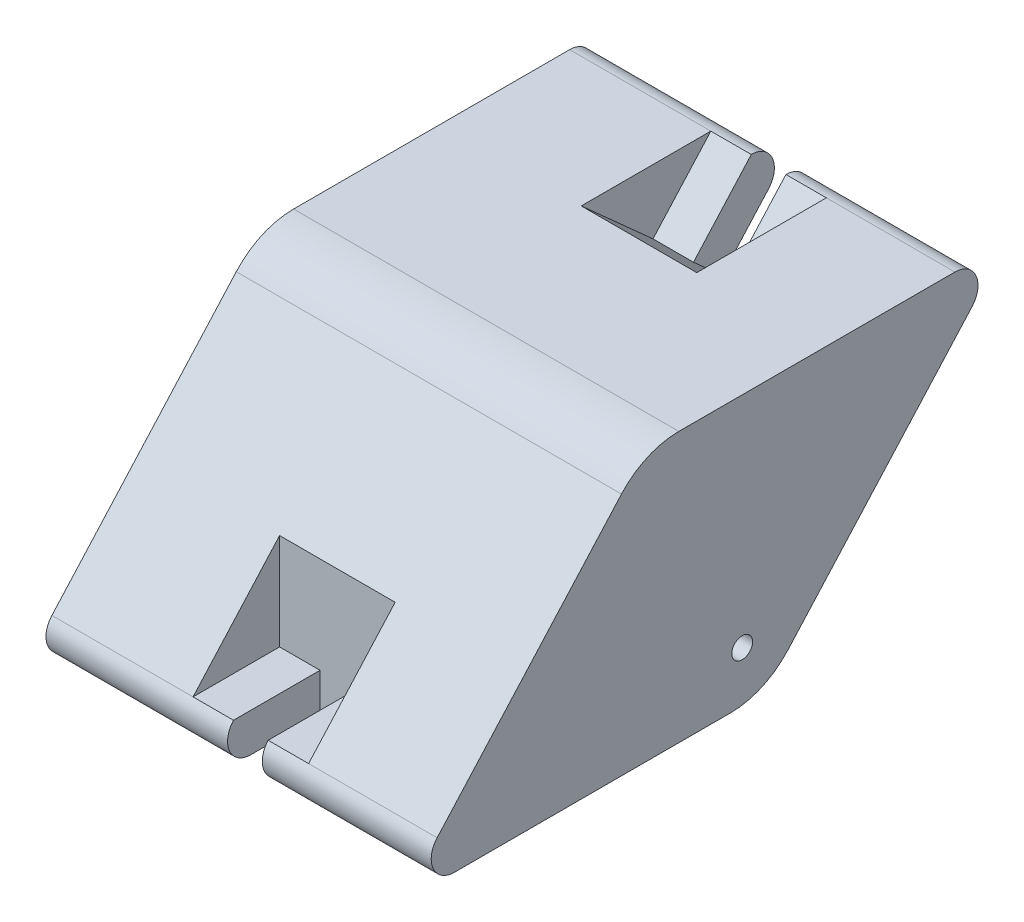
from build123d import *

# Parameters (mm, degrees)
SKETCH4_R            = 3.6
THICKBASE_DEPTH      = 10
MIDDLE_DEPTH         = 35
THINBASE_DEPTH       = 5
SKETCH8_R            = 1.35
RETAINERSCREW_DEPTH  = 5
SKETCH9_R            = 3
SKETCH9_R_2          = 1.35
SPACER_DEPTH         = 7.2
SHOCKHOLE_START      = -35
SKETCH10_W           = 4.5
SKETCH10_H           = 12
SHOCKHOLE_DEPTH      = 17.524613
SKETCH12_W           = 15
SKETCH12_H           = 12.521275246
SHOCKHOLEBASE_DEPTH  = 82.308539587
SKETCH11_W           = 4.5
SKETCH11_H           = 12
SHOCKHOLE2_DEPTH     = 35
SKETCH13_W           = 15
SKETCH13_H           = 12.521275247
SHOCKHOLE2BASE_DEPTH = 80.489490329


with BuildPart() as part:
    # Sketch4 → ThickBase (new body)
    with BuildSketch(Plane(origin=(0, 0, 0), x_dir=(0, 0, -1), z_dir=(1, 0, 0))):
        with BuildLine():
            Line((-14.01318338, 16.550216151), (21.822267157, 16.550216151))
            ThreePointArc((21.822267157, 16.550216151), (24.561793845, 14.77291543), (24.055345362, 11.546878503))
            Line((24.055345362, 11.546878503), (0.125176293, -15.12757601))
            ThreePointArc((0.125176293, -15.12757601), (-3.242753458, -17.581539475), (-7.318417722, -18.449783849))
            Line((-7.318417722, -18.449783849), (-43.153868259, -18.449783849))
            ThreePointArc((-43.153868259, -18.449783849), (-45.893394947, -16.672483128), (-45.386946464, -13.446446201))
            Line((-45.386946464, -13.446446201), (-21.456777395, 13.228008312))
            ThreePointArc((-21.456777395, 13.228008312), (-18.088847644, 15.681971777), (-14.01318338, 16.550216151))
        make_face()
        with Locations((-5.952745457, -11.509649573)):
            Circle(SKETCH4_R, mode=Mode.SUBTRACT)
    extrude(amount=THICKBASE_DEPTH)

    # Sketch5 → Middle (add)
    with BuildSketch(Plane(origin=(10, 0, 0), x_dir=(0, 0, -1), z_dir=(1, 0, 0))):
        with BuildLine():
            Line((15.945305194, 2.506787856), (24.055345362, 11.546878503))
            ThreePointArc((24.055345362, 11.546878503), (24.561793845, 14.77291543), (21.822267157, 16.550216151))
            Line((21.822267157, 16.550216151), (-14.01318338, 16.550216151))
            ThreePointArc((-14.01318338, 16.550216151), (-18.088847644, 15.681971777), (-21.456777395, 13.228008312))
            Line((-21.456777395, 13.228008312), (-45.386946464, -13.446446201))
            ThreePointArc((-45.386946464, -13.446446201), (-45.893394947, -16.672483128), (-43.153868259, -18.449783849))
            Line((-43.153868259, -18.449783849), (-31.009075531, -18.449783849))
            ThreePointArc((-31.009075531, -18.449783849), (-16.549356077, 12.232654103), (15.945305194, 2.506787856))
        make_face()
    extrude(amount=MIDDLE_DEPTH)

    # Sketch7 → ThinBase (add)
    with BuildSketch(Plane(origin=(45, 0, 0), x_dir=(0, 0, -1), z_dir=(1, 0, 0))):
        with BuildLine():
            ThreePointArc((15.945305194, 2.506787856), (-16.549356077, 12.232654103), (-31.009075531, -18.449783849))
            Line((-31.009075531, -18.449783849), (-7.318417722, -18.449783849))
            ThreePointArc((-7.318417722, -18.449783849), (-3.242753458, -17.581539475), (0.125176293, -15.12757601))
            Line((0.125176293, -15.12757601), (15.945305194, 2.506787856))
        make_face()
        with BuildLine():
            Line((-43.153868259, -18.449783849), (-31.009075531, -18.449783849))
            ThreePointArc((-31.009075531, -18.449783849), (-16.549356077, 12.232654103), (15.945305194, 2.506787856))
            Line((15.945305194, 2.506787856), (24.055345362, 11.546878503))
            ThreePointArc((24.055345362, 11.546878503), (24.561793845, 14.77291543), (21.822267157, 16.550216151))
            Line((21.822267157, 16.550216151), (-14.01318338, 16.550216151))
            ThreePointArc((-14.01318338, 16.550216151), (-18.088847644, 15.681971777), (-21.456777395, 13.228008312))
            Line((-21.456777395, 13.228008312), (-45.386946464, -13.446446201))
            ThreePointArc((-45.386946464, -13.446446201), (-45.893394947, -16.672483128), (-43.153868259, -18.449783849))
        make_face()
    extrude(amount=THINBASE_DEPTH)

    # Sketch8 → RetainerScrew (cut)
    with BuildSketch(Plane(origin=(50, 0, 0), x_dir=(0, 0, -1), z_dir=(1, 0, 0))):
        with Locations((-5.789718886, -11.874919798)):
            Circle(SKETCH8_R)
    extrude(amount=-RETAINERSCREW_DEPTH, mode=Mode.SUBTRACT)

    # Sketch9 → Spacer (add)
    with BuildSketch(Plane.ZY.offset(-45)):
        with Locations(Location((5.789718886, -11.874919798, 0), (0, 0, 180))):
            Circle(SKETCH9_R)
        with Locations(Location((5.789718886, -11.874919798, 0), (0, 0, 180))):
            Circle(SKETCH9_R_2, mode=Mode.SUBTRACT)
    extrude(amount=SPACER_DEPTH)

    # Sketch10 → ShockHole (cut)
    with BuildSketch(Plane(origin=(0, 16.564225392, 18.463792524), x_dir=(1, 0, 0), z_dir=(0, 0.6677792161146302, 0.7443594014488768)).offset(SHOCKHOLE_START)):
        with Locations((25.82, 21.65868724)):
            Rectangle(SKETCH10_W, SKETCH10_H)
    extrude(amount=SHOCKHOLE_DEPTH, mode=Mode.SUBTRACT)

    # Sketch12 → ShockHoleBase (cut, through all)
    with BuildSketch(Plane(origin=(0, 11.655691061, -10.45654589), x_dir=(1, 0, 0), z_dir=(0, 0.7443594014488766, -0.6677792161146304))):
        with Locations((25.82, -1.068918271)):
            Rectangle(SKETCH12_W, SKETCH12_H)
    extrude(amount=SHOCKHOLEBASE_DEPTH, mode=Mode.SUBTRACT)

    # Sketch11 → ShockHole2 (cut)
    with BuildSketch(Plane(origin=(0, 16.550216151, 0), x_dir=(1, 0, 0), z_dir=(0, 1, 0))):
        with Locations((25.82, -40.153868259)):
            Rectangle(SKETCH11_W, SKETCH11_H)
    extrude(amount=-SHOCKHOLE2_DEPTH, mode=Mode.SUBTRACT)

    # Sketch13 → ShockHole2Base (cut, through all)
    with BuildSketch(Plane.XY.offset(34.153868259)):
        with Locations((25.82, -7.185808578)):
            Rectangle(SKETCH13_W, SKETCH13_H)
    extrude(amount=SHOCKHOLE2BASE_DEPTH, mode=Mode.SUBTRACT)


solid = part.part
